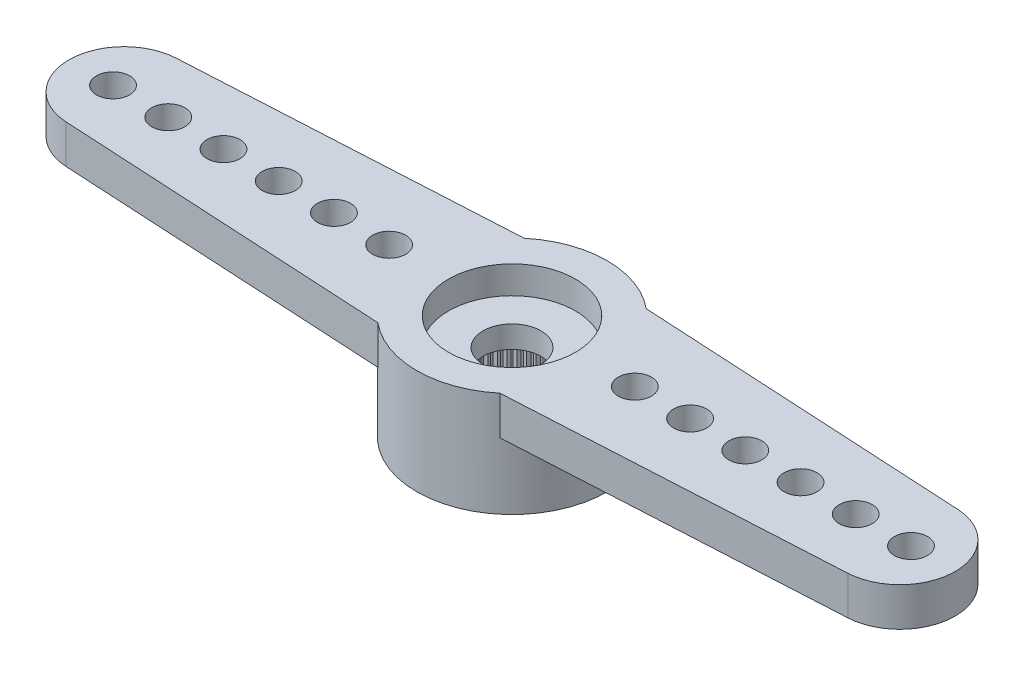
from build123d import *

# Parameters (mm, degrees)
RESSALTO_EXTRUS_O1_DEPTH = 1.4
ESBO_O2_R                = 3.45
RESSALTO_EXTRUS_O2_DEPTH = 2.4
FURO4_D                  = 1.2
PADR_O_LINEAR1_COUNT     = 6
PADR_O_LINEAR1_PITCH     = 2
PADR_OCIRCULAR2_COUNT    = 2
PADR_OCIRCULAR2_COPY_1_D = 1.2
PADR_OCIRCULAR2_COPY_2_D = 1.2
PADR_OCIRCULAR2_COPY_3_D = 1.2
PADR_OCIRCULAR2_COPY_4_D = 1.2
PADR_OCIRCULAR2_COPY_5_D = 1.2
FURO1_D                  = 4.95
FURO1_DEPTH              = 2
FURO2_D                  = 4.6
FURO2_DEPTH              = 1
FURO3_D                  = 2.1
RESSALTO_EXTRUS_O3_START = -2
RESSALTO_EXTRUS_O3_DEPTH = 2
PADR_OCIRCULAR1_COUNT    = 60


with BuildPart() as part:
    # Esboço1 → Ressalto-extrusão1 (new body)
    with BuildSketch(Plane(origin=(0, 0, 0), x_dir=(1, 0, 0), z_dir=(0, 1, 0))):
        with BuildLine():
            Line((-14.159121967, 1.99702088), (-2.209072203, 2.65))
            ThreePointArc((-2.209072203, 2.65), (3.45, 0), (-2.209072203, -2.65))
            Line((-2.209072203, -2.65), (-14.159121967, -1.99702088))
            ThreePointArc((-14.159121967, -1.99702088), (-16.05, 0), (-14.159121967, 1.99702088))
        make_face()
    ressalto_extrus_o1 = extrude(amount=-RESSALTO_EXTRUS_O1_DEPTH)

    # Esboço2 → Ressalto-extrusão2 (add)
    with BuildSketch(Plane.XZ.offset(1.4)):
        with Locations(Location((0, 0, 0), (0, 0, 90))):
            Circle(ESBO_O2_R)
    extrude(amount=RESSALTO_EXTRUS_O2_DEPTH)

    # Furo4 (through all)
    with Locations(Plane(origin=(0, 0, 0), x_dir=(1, 0, 0), z_dir=(0, 1, 0))):
        with Locations((-14.45, 0)):
            furo4 = Hole(FURO4_D / 2)

    # Padrão linear1: Furo4 ×6
    with Locations(*[(i * PADR_O_LINEAR1_PITCH, 0, 0) for i in range(1, PADR_O_LINEAR1_COUNT)]):
        add(furo4, mode=Mode.SUBTRACT)

    # PadrãoCircular2: Ressalto-extrusão1, Furo4 ×2 about axis
    padr_ocircular2_axis = Axis((0, 0, 0), (0, 1, 0))
    add([ressalto_extrus_o1.rotate(padr_ocircular2_axis, i * 360 / PADR_OCIRCULAR2_COUNT) for i in range(1, PADR_OCIRCULAR2_COUNT)])
    add([furo4.rotate(padr_ocircular2_axis, i * 360 / PADR_OCIRCULAR2_COUNT) for i in range(1, PADR_OCIRCULAR2_COUNT)], mode=Mode.SUBTRACT)

    # PadrãoCircular2 copy 1 (through all)
    with Locations(Plane(origin=(-2, 0, 0), x_dir=(-1, 0, 0), z_dir=(0, 1, 0))):
        with Locations((-14.45, 0)):
            Hole(PADR_OCIRCULAR2_COPY_1_D / 2)

    # PadrãoCircular2 copy 2 (through all)
    with Locations(Plane(origin=(-4, 0, 0), x_dir=(-1, 0, 0), z_dir=(0, 1, 0))):
        with Locations((-14.45, 0)):
            Hole(PADR_OCIRCULAR2_COPY_2_D / 2)

    # PadrãoCircular2 copy 3 (through all)
    with Locations(Plane(origin=(-6, 0, 0), x_dir=(-1, 0, 0), z_dir=(0, 1, 0))):
        with Locations((-14.45, 0)):
            Hole(PADR_OCIRCULAR2_COPY_3_D / 2)

    # PadrãoCircular2 copy 4 (through all)
    with Locations(Plane(origin=(-8, 0, 0), x_dir=(-1, 0, 0), z_dir=(0, 1, 0))):
        with Locations((-14.45, 0)):
            Hole(PADR_OCIRCULAR2_COPY_4_D / 2)

    # PadrãoCircular2 copy 5 (through all)
    with Locations(Plane(origin=(-10, 0, 0), x_dir=(-1, 0, 0), z_dir=(0, 1, 0))):
        with Locations((-14.45, 0)):
            Hole(PADR_OCIRCULAR2_COPY_5_D / 2)

    # Furo1
    with Locations(Plane(origin=(0, -3.8, 0), x_dir=(-1, 0, 0), z_dir=(0, -1, 0))):
        with Locations((0, 0)):
            Hole(FURO1_D / 2, depth=FURO1_DEPTH)

    # Furo2
    with Locations(Plane(origin=(0, 0, 0), x_dir=(1, 0, 0), z_dir=(0, 1, 0))):
        with Locations((0, 0)):
            Hole(FURO2_D / 2, depth=FURO2_DEPTH)

    # Furo3 (through all)
    with Locations(Plane(origin=(0, 0, 0), x_dir=(1, 0, 0), z_dir=(0, 1, 0))):
        with Locations((0, 0)):
            Hole(FURO3_D / 2)

    # Esboço11 → Ressalto-extrusão3 (add)
    with BuildSketch(Plane.XZ.offset(3.8).offset(RESSALTO_EXTRUS_O3_START)):
        with BuildLine():
            Line((-0.098056786, 2.473056786), (0, 2.375))
            Line((0, 2.375), (0.098056786, 2.473056786))
            ThreePointArc((0.098056786, 2.473056786), (0, 2.475), (-0.098056786, 2.473056786))
        make_face()
    ressalto_extrus_o3 = extrude(amount=RESSALTO_EXTRUS_O3_DEPTH)

    # PadrãoCircular1: Ressalto-extrusão3 ×60 about axis
    padr_ocircular1_axis = Axis((0, 0, 0), (0, 1, 0))
    for i in range(1, PADR_OCIRCULAR1_COUNT):
        add(ressalto_extrus_o3.rotate(padr_ocircular1_axis, i * 360 / PADR_OCIRCULAR1_COUNT))


solid = part.part
